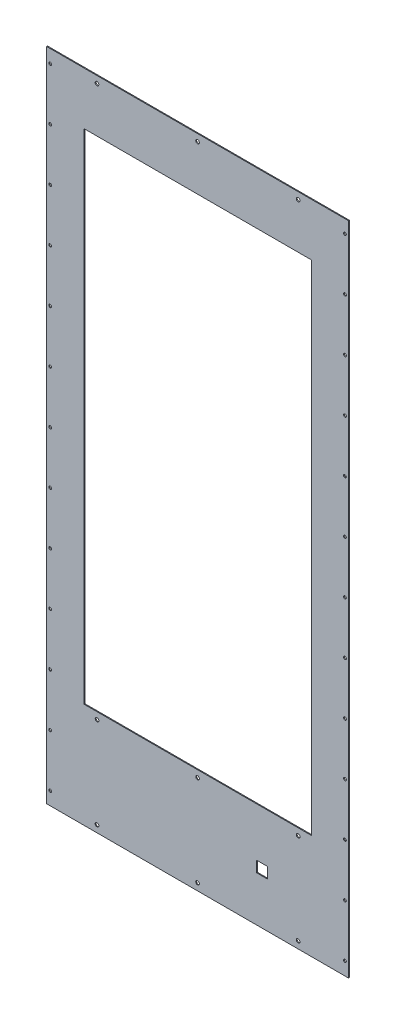
from build123d import *

# Parameters (mm, degrees)
SKETCH1_W           = 345
SKETCH1_H           = 750
SKETCH1_R           = 2.1
SKETCH1_W_2         = 260
SKETCH1_H_2         = 570
SKETCH1_W_3         = 12.5
SKETCH1_H_3         = 12.5
BOSS_EXTRUDE1_DEPTH = 1
SKETCH2_R           = 1.6
CUT_EXTRUDE1_DEPTH  = 1
SKETCH3_R           = 1.6
CUT_EXTRUDE2_DEPTH  = 1


with BuildPart() as part:
    # Sketch1 → Boss-Extrude1 (new body)
    with BuildSketch(Plane.XY):
        with Locations((-501.064232917, -457.603531907)):
            Rectangle(SKETCH1_W, SKETCH1_H)
        with Locations((-501.064232917, -90.603531907)):
            Circle(SKETCH1_R, mode=Mode.SUBTRACT)
        with Locations((-616.064232917, -90.603531907)):
            Circle(SKETCH1_R, mode=Mode.SUBTRACT)
        with Locations((-386.064232917, -90.603531907)):
            Circle(SKETCH1_R, mode=Mode.SUBTRACT)
        with Locations((-616.01978091, -720.603531907)):
            Circle(SKETCH1_R, mode=Mode.SUBTRACT)
        with Locations((-501.01978091, -720.603531907)):
            Circle(SKETCH1_R, mode=Mode.SUBTRACT)
        with Locations((-386.01978091, -720.603531907)):
            Circle(SKETCH1_R, mode=Mode.SUBTRACT)
        with Locations((-386.064232917, -824.603531907)):
            Circle(SKETCH1_R, mode=Mode.SUBTRACT)
        with Locations((-501.064232917, -824.603531907)):
            Circle(SKETCH1_R, mode=Mode.SUBTRACT)
        with Locations((-616.064232917, -824.603531907)):
            Circle(SKETCH1_R, mode=Mode.SUBTRACT)
        with Locations((-501.01978091, -427.603531907)):
            Rectangle(SKETCH1_W_2, SKETCH1_H_2, mode=Mode.SUBTRACT)
        with Locations((-427.16978091, -774.653531907)):
            Rectangle(SKETCH1_W_3, SKETCH1_H_3, mode=Mode.SUBTRACT)
    extrude(amount=BOSS_EXTRUDE1_DEPTH)

    # Sketch2 → Cut-Extrude1 (cut)
    with BuildSketch(Plane.XY.offset(1)):
        with Locations((-669.634232917, -97.603531907)):
            Circle(SKETCH2_R)
        with Locations((-669.634232917, -817.603531907)):
            Circle(SKETCH2_R)
        with Locations((-669.634232917, -757.603531907)):
            Circle(SKETCH2_R)
        with Locations((-669.634232917, -697.603531907)):
            Circle(SKETCH2_R)
        with Locations((-669.634232917, -637.603531907)):
            Circle(SKETCH2_R)
        with Locations((-669.634232917, -577.603531907)):
            Circle(SKETCH2_R)
        with Locations((-669.634232917, -517.603531907)):
            Circle(SKETCH2_R)
        with Locations((-669.634232917, -457.603531907)):
            Circle(SKETCH2_R)
        with Locations((-669.634232917, -397.603531907)):
            Circle(SKETCH2_R)
        with Locations((-669.634232917, -337.603531907)):
            Circle(SKETCH2_R)
        with Locations((-669.634232917, -277.603531907)):
            Circle(SKETCH2_R)
        with Locations((-669.634232917, -217.603531907)):
            Circle(SKETCH2_R)
        with Locations((-669.634232917, -157.603531907)):
            Circle(SKETCH2_R)
    extrude(amount=-CUT_EXTRUDE1_DEPTH, mode=Mode.SUBTRACT)

    # Sketch3 → Cut-Extrude2 (cut)
    with BuildSketch(Plane.XY.offset(1)):
        with Locations((-332.514232917, -97.603531907)):
            Circle(SKETCH3_R)
        with Locations((-332.514232917, -817.603531907)):
            Circle(SKETCH3_R)
        with Locations((-332.514232917, -757.603531907)):
            Circle(SKETCH3_R)
        with Locations((-332.514232917, -697.603531907)):
            Circle(SKETCH3_R)
        with Locations((-332.514232917, -637.603531907)):
            Circle(SKETCH3_R)
        with Locations((-332.514232917, -577.603531907)):
            Circle(SKETCH3_R)
        with Locations((-332.514232917, -517.603531907)):
            Circle(SKETCH3_R)
        with Locations((-332.514232917, -457.603531907)):
            Circle(SKETCH3_R)
        with Locations((-332.514232917, -397.603531907)):
            Circle(SKETCH3_R)
        with Locations((-332.514232917, -337.603531907)):
            Circle(SKETCH3_R)
        with Locations((-332.514232917, -277.603531907)):
            Circle(SKETCH3_R)
        with Locations((-332.514232917, -217.603531907)):
            Circle(SKETCH3_R)
        with Locations((-332.514232917, -157.603531907)):
            Circle(SKETCH3_R)
    extrude(amount=-CUT_EXTRUDE2_DEPTH, mode=Mode.SUBTRACT)


solid = part.part
